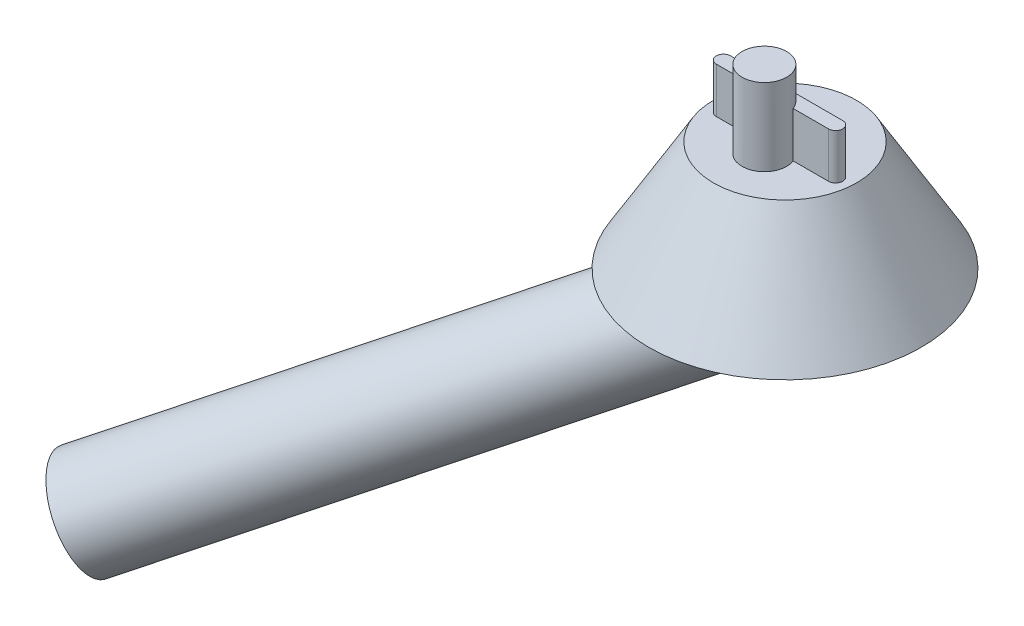
from build123d import *

# Parameters (mm, degrees)
SKETCH2_R                       = 3.35
BOSS_EXTRUDE1_DEPTH             = 11.6
BOSS_EXTRUDE2_DEPTH             = 6.82
SKETCH8_R                       = 7.5
BOSS_EXTRUDE3_DEPTH             = 80
BOSS_EXTRUDE3_DIRECTION_2_REACH = 50.394


with BuildPart() as part:
    # Sketch1 → Revolve1 (revolve)
    with BuildSketch(Plane(origin=(0, 0, 0), x_dir=(0, 0, -1), z_dir=(1, 0, 0)), mode=Mode.PRIVATE) as revolve1_sk:
        Polygon((0, 16.5), (0, 0), (20.5, 0), (10.75, 16.5), align=None)
    revolve(revolve1_sk.sketch.rotate(Axis((0, 16.5, 0), (0, -1, 0)), 180), axis=Axis((0, 16.5, 0), (0, -1, 0)))

    # Sketch2 → Boss-Extrude1 (add)
    with BuildSketch(Plane(origin=(0, 16.5, 0), x_dir=(1, 0, 0), z_dir=(0, 1, 0))):
        with Locations(Location((0, -3.1, 0), (0, 0, 270))):
            Circle(SKETCH2_R)
    extrude(amount=BOSS_EXTRUDE1_DEPTH)

    # Sketch3 → Boss-Extrude2 (add)
    with BuildSketch(Plane(origin=(0, 16.5, 0), x_dir=(1, 0, 0), z_dir=(0, 1, 0))):
        with BuildLine():
            Line((-8.425, 0.25), (8.425, 0.25))
            ThreePointArc((8.425, 0.25), (9.5, -0.825), (8.425, -1.9))
            Line((8.425, -1.9), (-8.425, -1.9))
            ThreePointArc((-8.425, -1.9), (-9.5, -0.825), (-8.425, 0.25))
        make_face()
    extrude(amount=BOSS_EXTRUDE2_DEPTH)

    # Sketch8 → Boss-Extrude3 (add)
    with BuildSketch(Plane(origin=(-6.20436158, -4.094388045, 3.839162967), x_dir=(0.5261928654830319, 0, 0.8503652558252577), z_dir=(-0.7415774099490876, -0.4893824517488441, 0.458876629360761))):
        with Locations(Location((0, -1, 0), (0, 0, 286.847482278))):
            Circle(SKETCH8_R)
    extrude(amount=BOSS_EXTRUDE3_DEPTH)

    # Sketch8 → Boss-Extrude3 direction 2 (add, up to next)
    with BuildSketch(Plane(origin=(-6.20436158, -4.094388045, 3.839162967), x_dir=(0.5261928654830319, 0, 0.8503652558252577), z_dir=(-0.7415774099490876, -0.4893824517488441, 0.458876629360761)), mode=Mode.PRIVATE) as boss_extrude3_direction_2_sk1:
        with Locations(Location((0, -1, 0), (0, 0, 286.847482278))):
            Circle(SKETCH8_R)
    boss_extrude3_direction_2_tool1 = extrude(boss_extrude3_direction_2_sk1.sketch, amount=-BOSS_EXTRUDE3_DIRECTION_2_REACH, mode=Mode.PRIVATE) - part.part
    add(boss_extrude3_direction_2_tool1.solids().sort_by_distance((-5.788208, -4.966457, 3.581653))[0])


solid = part.part
